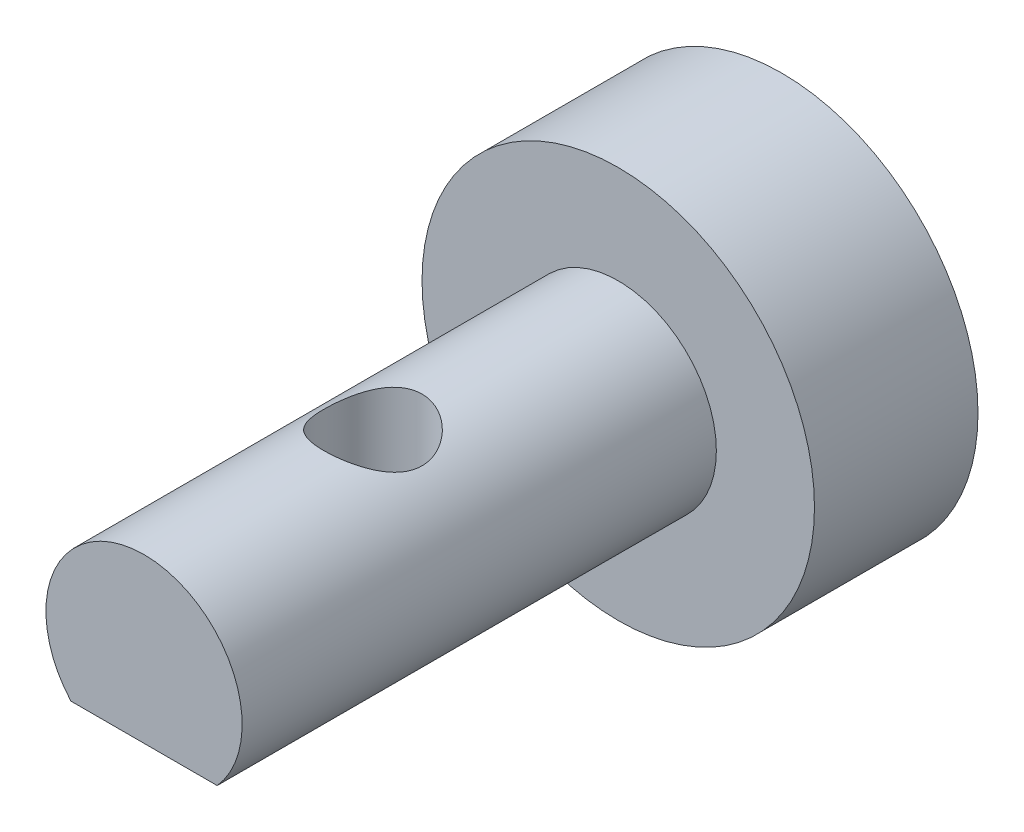
from build123d import *

# Parameters (mm, degrees)
SKETCH1_R               = 6
BOSS_EXTRUDE1_DEPTH     = 5
SKETCH2_R               = 3
BOSS_EXTRUDE2_DEPTH     = 2.5
BOSS_EXTRUDE3_DEPTH     = 12
CUT_EXTRUDE1_REACH      = 23.915
CUT_EXTRUDE1_END_RADIUS = 3
SKETCH4_R               = 1.5


with BuildPart() as part:
    # Sketch1 → Boss-Extrude1 (new body)
    with BuildSketch(Plane.XY):
        Circle(SKETCH1_R)
    extrude(amount=BOSS_EXTRUDE1_DEPTH)

    # Sketch2 → Boss-Extrude2 (add)
    with BuildSketch(Plane.XY.offset(5)):
        Circle(SKETCH2_R)
    extrude(amount=BOSS_EXTRUDE2_DEPTH)

    # Sketch3 → Boss-Extrude3 (add)
    with BuildSketch(Plane.XY.offset(7.5)):
        with BuildLine():
            Line((-2.236067977, -2), (2.236067977, -2))
            ThreePointArc((2.236067977, -2), (0, 3), (-2.236067977, -2))
        make_face()
    extrude(amount=BOSS_EXTRUDE3_DEPTH)

    # Cut-Extrude1: up to this cylinder (the profile starts inside it)
    cut_extrude1_end = Plane(origin=(0, 0, 12.5), z_dir=(0, 0, -1)) * Cylinder(CUT_EXTRUDE1_END_RADIUS, 54.83, mode=Mode.PRIVATE)
    # Sketch4 → Cut-Extrude1 (cut, up to the surface)
    with BuildSketch(Plane.XZ.offset(2), mode=Mode.PRIVATE) as cut_extrude1_sk1:
        with Locations(Location((0, 12.5, 0), (0, 0, 270))):
            Circle(SKETCH4_R)
    cut_extrude1_tool1 = extrude(cut_extrude1_sk1.sketch, amount=-CUT_EXTRUDE1_REACH, mode=Mode.PRIVATE) & cut_extrude1_end
    add(cut_extrude1_tool1.solids().sort_by_distance((0, -2, 12.5))[0], mode=Mode.SUBTRACT)


solid = part.part
